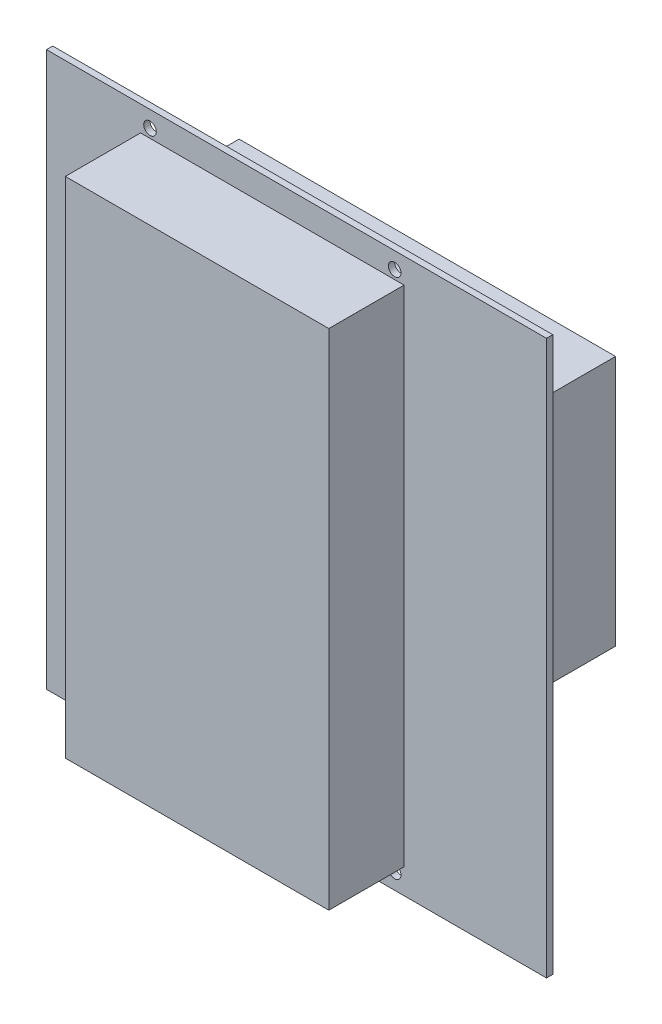
from build123d import *

# Parameters (mm, degrees)
SKETCH1_W               = 101.219
SKETCH1_H               = 112.141
BOSS_EXTRUDE1_DEPTH     = 1.27
SKETCH2_W               = 53.34
SKETCH2_H               = 101.981
BOSS_EXTRUDE2_DEPTH     = 15.24
SKETCH3_W               = 76.2
SKETCH3_H               = 50.8
BOSS_EXTRUDE3_DEPTH     = 21.59
CUT_EXTRUDE1_DEPTH      = 79.916424529
CUT_EXTRUDE1_DEPTH_BACK = 79.916424529
SKETCH4_R               = 1.27


with BuildPart() as part:
    # Sketch1 → Boss-Extrude1 (new body)
    with BuildSketch(Plane.XY):
        Rectangle(SKETCH1_W, SKETCH1_H)
    extrude(amount=BOSS_EXTRUDE1_DEPTH)

    # Sketch2 → Boss-Extrude2 (add)
    with BuildSketch(Plane.XY.offset(1.27)):
        with Locations((-4.8895, 0)):
            Rectangle(SKETCH2_W, SKETCH2_H)
    extrude(amount=BOSS_EXTRUDE2_DEPTH)

    # Sketch3 → Boss-Extrude3 (add)
    with BuildSketch(Plane(origin=(0, 0, 0), x_dir=(-1, 0, 0), z_dir=(0, 0, -1))):
        with Locations((-3.6195, 11.6205)):
            Rectangle(SKETCH3_W, SKETCH3_H)
    extrude(amount=BOSS_EXTRUDE3_DEPTH)

    # Sketch4 → Cut-Extrude1 (cut, two sides: drawn at the far end of the back side and taken through both)
    with BuildSketch(Plane.XY.offset(1.27).offset(-CUT_EXTRUDE1_DEPTH_BACK)):
        with Locations(Location((-29.6545, 52.7685, 0), (0, 0, 180))):
            Circle(SKETCH4_R)
        with Locations(Location((19.8755, 52.7685, 0), (0, 0, 180))):
            Circle(SKETCH4_R)
        with Locations(Location((-29.6545, -52.7685, 0), (0, 0, 180))):
            Circle(SKETCH4_R)
        with Locations(Location((19.8755, -52.7685, 0), (0, 0, 180))):
            Circle(SKETCH4_R)
    extrude(amount=CUT_EXTRUDE1_DEPTH + CUT_EXTRUDE1_DEPTH_BACK, mode=Mode.SUBTRACT)


solid = part.part
